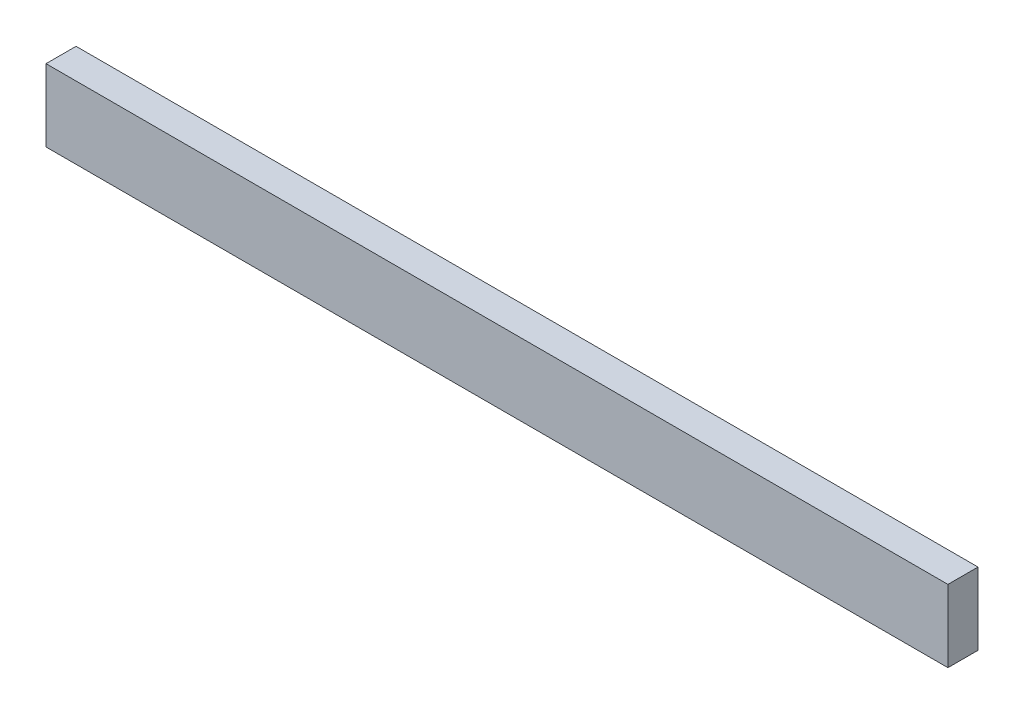
from build123d import *

# Parameters (mm, degrees)
ESQUISSE1_W        = 750
ESQUISSE1_H        = 60
BOSS_EXTRU_1_DEPTH = 25


with BuildPart() as part:
    # Esquisse1 → Boss.-Extru.1 (new body)
    with BuildSketch(Plane.XY):
        with Locations((375, 30)):
            Rectangle(ESQUISSE1_W, ESQUISSE1_H)
    extrude(amount=BOSS_EXTRU_1_DEPTH)


solid = part.part
